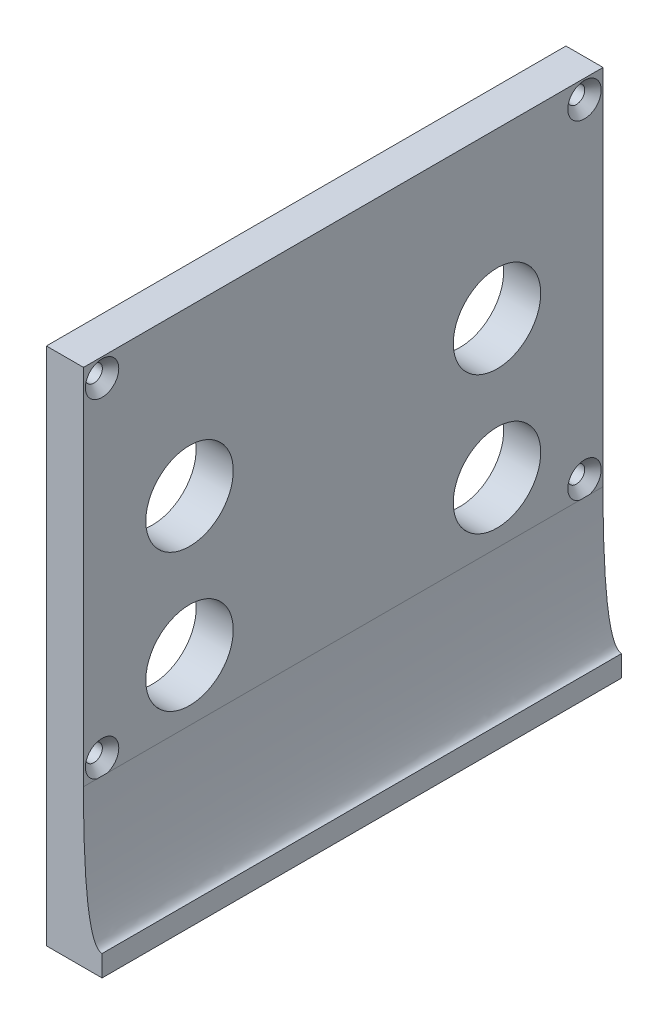
from build123d import *

# Parameters (mm, degrees)
BOSS_EXTRUDE1_DEPTH                            = 98
SKETCH2_R                                      = 8.25
CUT_EXTRUDE1_DEPTH                             = 114.573245575
CSK_FOR_M3_FLAT_HEAD_MACHINE_SCREW2_AT_2_COUNT = 2
CSK_FOR_M3_FLAT_HEAD_MACHINE_SCREW2_AT_2_PITCH = 62
CSK_FOR_M3_FLAT_HEAD_MACHINE_SCREW2_AT_3_COUNT = 2
CSK_FOR_M3_FLAT_HEAD_MACHINE_SCREW2_AT_3_PITCH = 110.113577728
CSK_FOR_M3_FLAT_HEAD_MACHINE_SCREW2_AT_4_COUNT = 2
CSK_FOR_M3_FLAT_HEAD_MACHINE_SCREW2_AT_4_PITCH = 91
SKETCH9_W                                      = 29.5
SKETCH9_H                                      = 7
CUT_EXTRUDE2_DEPTH                             = 2.5


with BuildPart() as part:
    # Sketch1 → Boss-Extrude1 (new body)
    with BuildSketch(Plane.XY):
        with BuildLine():
            Line((-46.838690812, 41.567455511), (-46.838690812, -56.432544489))
            Line((-46.838690812, -56.432544489), (-36.338690812, -56.432544489))
            Line((-36.338690812, -56.432544489), (-36.338690812, -52.432544489))
            add(Edge.make_bspline(
                [(-39.838690812, -26.932544489), (-39.838690812, -52.432544489), (-36.338690812, -52.432544489)],
                knots=[0, 0, 0, 1, 1, 1], degree=2))
            Line((-39.838690812, -26.932544489), (-39.838690812, 41.567455511))
            Line((-39.838690812, 41.567455511), (-46.838690812, 41.567455511))
        make_face()
    extrude(amount=BOSS_EXTRUDE1_DEPTH)

    # Sketch2 → Cut-Extrude1 (cut, through all)
    with BuildSketch(Plane.ZY.offset(46.838690812)):
        with Locations((20, 10.567455511)):
            Circle(SKETCH2_R)
        with Locations((78, 10.567455511)):
            Circle(SKETCH2_R)
        with Locations((78, -15.432544489)):
            Circle(SKETCH2_R)
        with Locations((20, -15.432544489)):
            Circle(SKETCH2_R)
    extrude(amount=-CUT_EXTRUDE1_DEPTH, mode=Mode.SUBTRACT)

    # Sketch8 → CSK for M3 Flat Head Machine Screw2 (revolve, cut)
    with BuildSketch(Plane(origin=(-39.838690812, 38.067455511, 94.5), x_dir=(0, 0, -1), z_dir=(0, 1, 0))):
        Polygon((0, 0), (0, 10.96137699), (1.6, 10), (1.6, 1.55), (3.15, 0), align=None)
    csk_for_m3_flat_head_machine_screw2 = revolve(axis=Axis((-33.488690812, 38.067455511, 94.5), (-1, 0, 0)), mode=Mode.SUBTRACT)

    # CSK for M3 Flat Head Machine Screw2 at 2: CSK for M3 Flat Head Machine Screw2 ×2
    with Locations(*[(0, -i * CSK_FOR_M3_FLAT_HEAD_MACHINE_SCREW2_AT_2_PITCH, 0) for i in range(1, CSK_FOR_M3_FLAT_HEAD_MACHINE_SCREW2_AT_2_COUNT)]):
        add(csk_for_m3_flat_head_machine_screw2, mode=Mode.SUBTRACT)

    # CSK for M3 Flat Head Machine Screw2 at 3: CSK for M3 Flat Head Machine Screw2 ×2
    with Locations(*[Vector(0, -0.5630549953912599, -0.8264194287194296) * (i * CSK_FOR_M3_FLAT_HEAD_MACHINE_SCREW2_AT_3_PITCH) for i in range(1, CSK_FOR_M3_FLAT_HEAD_MACHINE_SCREW2_AT_3_COUNT)]):
        add(csk_for_m3_flat_head_machine_screw2, mode=Mode.SUBTRACT)

    # CSK for M3 Flat Head Machine Screw2 at 4: CSK for M3 Flat Head Machine Screw2 ×2
    with Locations(*[(0, 0, -i * CSK_FOR_M3_FLAT_HEAD_MACHINE_SCREW2_AT_4_PITCH) for i in range(1, CSK_FOR_M3_FLAT_HEAD_MACHINE_SCREW2_AT_4_COUNT)]):
        add(csk_for_m3_flat_head_machine_screw2, mode=Mode.SUBTRACT)

    # Sketch9 → Cut-Extrude2 (cut)
    with BuildSketch(Plane.ZY.offset(46.838690812)):
        with Locations((54.25, 36.567455511)):
            Rectangle(SKETCH9_W, SKETCH9_H)
    extrude(amount=-CUT_EXTRUDE2_DEPTH, mode=Mode.SUBTRACT)


solid = part.part
